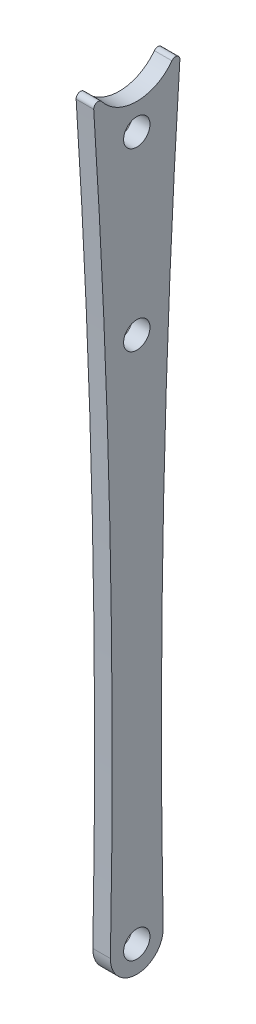
from build123d import *

# Parameters (mm, degrees)
SKETCH_1_R      = 1.5
EXTRUDE_1_DEPTH = 2


with BuildPart() as part:
    # 草图1 → 凸台-拉伸1 (new body)
    with BuildSketch(Plane(origin=(0, 0, 0), x_dir=(0, 0, -1), z_dir=(1, 0, 0))):
        with BuildLine():
            ThreePointArc((-2.999407201, 0.059635923), (0, -3), (2.999407201, 0.059635923))
            ThreePointArc((2.999407201, 0.059635923), (3.053738623, 42.383739267), (4.898951428, 84.667635321))
            ThreePointArc((4.898951428, 84.667635321), (4.573390935, 85.168972903), (4, 85))
            ThreePointArc((4, 85), (0, 83), (-4, 85))
            ThreePointArc((-4, 85), (-4.573390935, 85.168972903), (-4.898951428, 84.667635321))
            ThreePointArc((-4.898951428, 84.667635321), (-3.053738623, 42.383739267), (-2.999407201, 0.059635923))
        make_face()
        Circle(SKETCH_1_R, mode=Mode.SUBTRACT)
        with Locations((0, 80)):
            Circle(SKETCH_1_R, mode=Mode.SUBTRACT)
        with Locations((0, 60)):
            Circle(SKETCH_1_R, mode=Mode.SUBTRACT)
    extrude(amount=EXTRUDE_1_DEPTH)


solid = part.part
